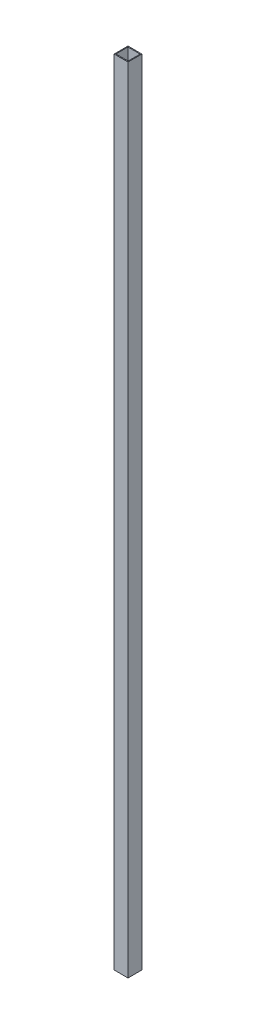
from build123d import *

# Parameters (mm, degrees)
SKETCH1_W           = 20
SKETCH1_H           = 20
BOSS_EXTRUDE1_DEPTH = 1143
SKETCH2_W           = 17.675538218
SKETCH2_H           = 17.34907709
CUT_EXTRUDE1_DEPTH  = 1143


with BuildPart() as part:
    # Sketch1 → Boss-Extrude1 (new body)
    with BuildSketch(Plane(origin=(0, 0, 0), x_dir=(1, 0, 0), z_dir=(0, 1, 0))):
        Rectangle(SKETCH1_W, SKETCH1_H)
    extrude(amount=BOSS_EXTRUDE1_DEPTH)

    # Sketch2 → Cut-Extrude1 (cut)
    with BuildSketch(Plane.XZ):
        Rectangle(SKETCH2_W, SKETCH2_H)
    extrude(amount=-CUT_EXTRUDE1_DEPTH, mode=Mode.SUBTRACT)


solid = part.part
